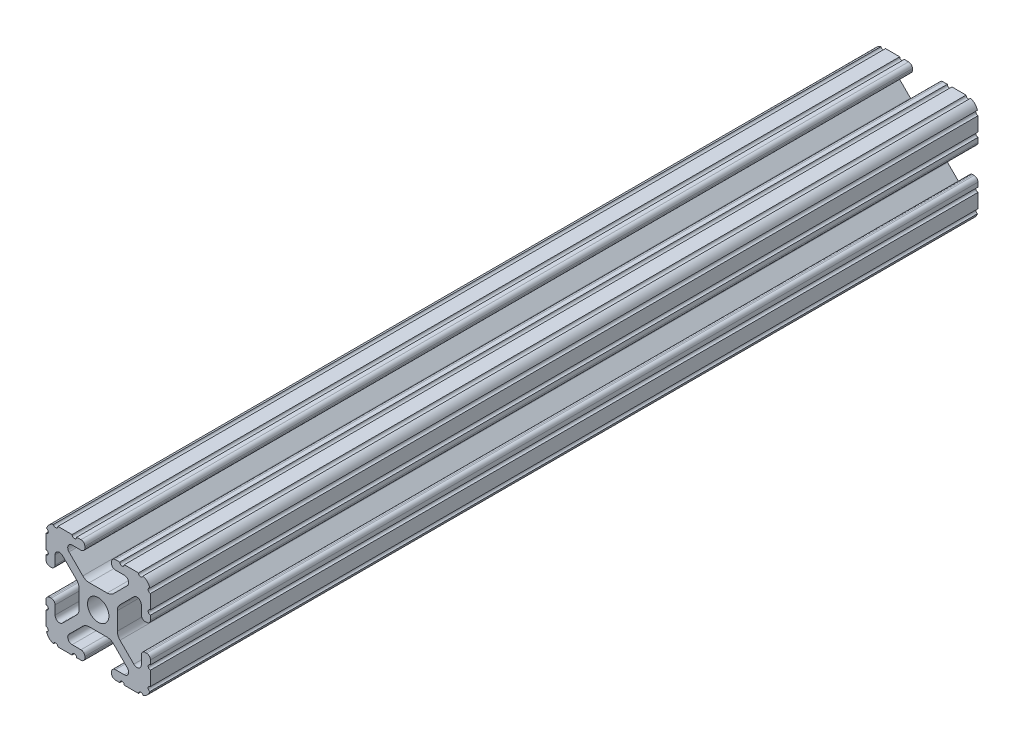
from build123d import *

# Parameters (mm, degrees)
BOSS_EXTRUDE1_START     = -100.679312
BOSS_EXTRUDE1_DEPTH     = 201.358624
CUT_EXTRUDE1_DEPTH      = 103.268782455
CUT_EXTRUDE1_DEPTH_BACK = 103.268782455
SKETCH5_R               = 0.55245


with BuildPart() as part:
    # Sketch4 → Boss-Extrude1 (new body)
    with BuildSketch(Plane.XY.offset(BOSS_EXTRUDE1_START)):
        with BuildLine():
            Line((4.190365, -12.7), (10.11729625, -12.7))
            ThreePointArc((10.11729625, -12.7), (11.943543585, -11.943543585), (12.7, -10.11729625))
            Line((12.7, -10.11729625), (12.7, -4.190365))
            ThreePointArc((12.7, -4.190365), (12.42492494, -3.52627506), (11.760835, -3.2512))
            Line((11.760835, -3.2512), (11.429365, -3.2512))
            ThreePointArc((11.429365, -3.2512), (10.76527506, -3.52627506), (10.4902, -4.190365))
            Line((10.4902, -4.190365), (10.4902, -6.348478019))
            ThreePointArc((10.4902, -6.348478019), (9.830707141, -7.335478831), (8.666460301, -7.103895736))
            Line((8.666460301, -7.103895736), (5.299899128, -3.737334563))
            ThreePointArc((5.299899128, -3.737334563), (4.817571085, -3.015479634), (4.6482, -2.16399369))
            Line((4.6482, -2.16399369), (4.6482, 0))
            Line((4.6482, 0), (2.6035, 0))
            ThreePointArc((2.6035, 0), (1.840952505, -1.840952505), (0, -2.6035))
            Line((0, -2.6035), (0, -4.6482))
            Line((0, -4.6482), (2.16399369, -4.6482))
            ThreePointArc((2.16399369, -4.6482), (3.015479634, -4.817571085), (3.737334563, -5.299899128))
            Line((3.737334563, -5.299899128), (7.103895736, -8.666460301))
            ThreePointArc((7.103895736, -8.666460301), (7.335478831, -9.830707141), (6.348478019, -10.4902))
            Line((6.348478019, -10.4902), (4.190365, -10.4902))
            ThreePointArc((4.190365, -10.4902), (3.52627506, -10.76527506), (3.2512, -11.429365))
            Line((3.2512, -11.429365), (3.2512, -11.760835))
            ThreePointArc((3.2512, -11.760835), (3.52627506, -12.42492494), (4.190365, -12.7))
        make_face()
    extrude(amount=BOSS_EXTRUDE1_DEPTH)

    # Sketch5 → Cut-Extrude1 (cut, two sides: drawn at the far end of the back side and taken through both)
    with BuildSketch(Plane.XY.offset(-CUT_EXTRUDE1_DEPTH_BACK)):
        with Locations((10.356153152, -12.7)):
            Circle(SKETCH5_R)
        with Locations((5.796028019, -12.7)):
            Circle(SKETCH5_R)
        with Locations((12.7, -10.356153152)):
            Circle(SKETCH5_R)
        with Locations((12.7, -5.796028019)):
            Circle(SKETCH5_R)
    extrude(amount=CUT_EXTRUDE1_DEPTH + CUT_EXTRUDE1_DEPTH_BACK, mode=Mode.SUBTRACT)

    # Mirror1: part across plane


with BuildPart() as part_1:
    add(part.part)
    add(part.part.mirror(Plane(origin=(0, 0, 0), x_dir=(0, 0, 1), z_dir=(1, 0, 0))))

    # Mirror2: part across plane


with BuildPart() as part_2:
    add(part_1.part)
    add(part_1.part.mirror(Plane.ZX))


solid = part_2.part
